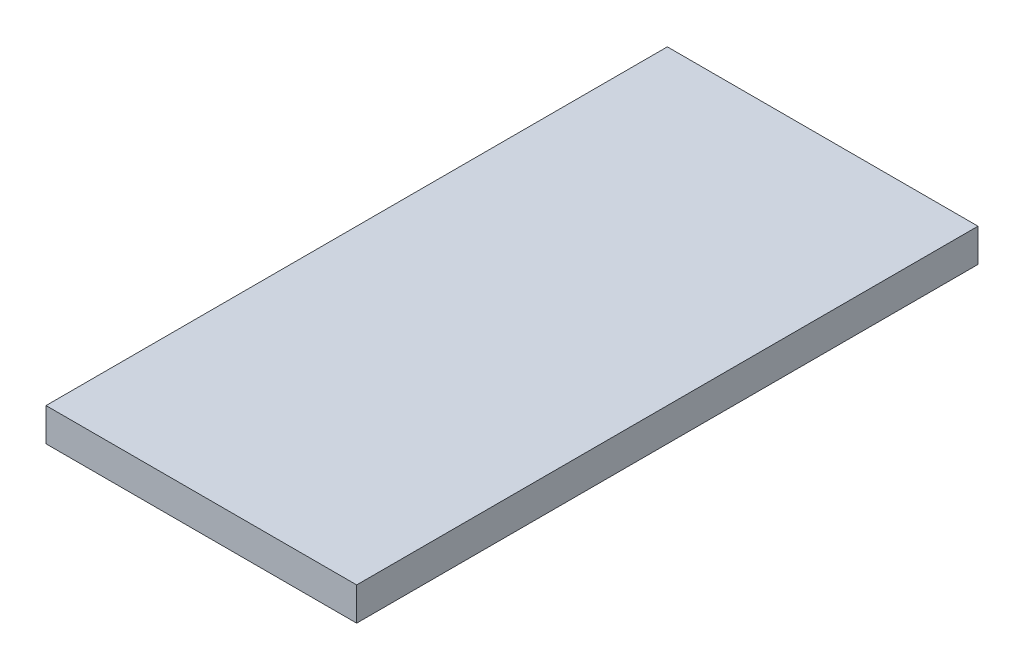
from build123d import *

# Parameters (mm, degrees)
SKETCH1_W           = 15
SKETCH1_H           = 30
BOSS_EXTRUDE1_DEPTH = 1.6


with BuildPart() as part:
    # Sketch1 → Boss-Extrude1 (new body)
    with BuildSketch(Plane(origin=(0, 0, 0), x_dir=(1, 0, 0), z_dir=(0, 1, 0))):
        with Locations((7.5, 15)):
            Rectangle(SKETCH1_W, SKETCH1_H)
    extrude(amount=BOSS_EXTRUDE1_DEPTH)


solid = part.part
